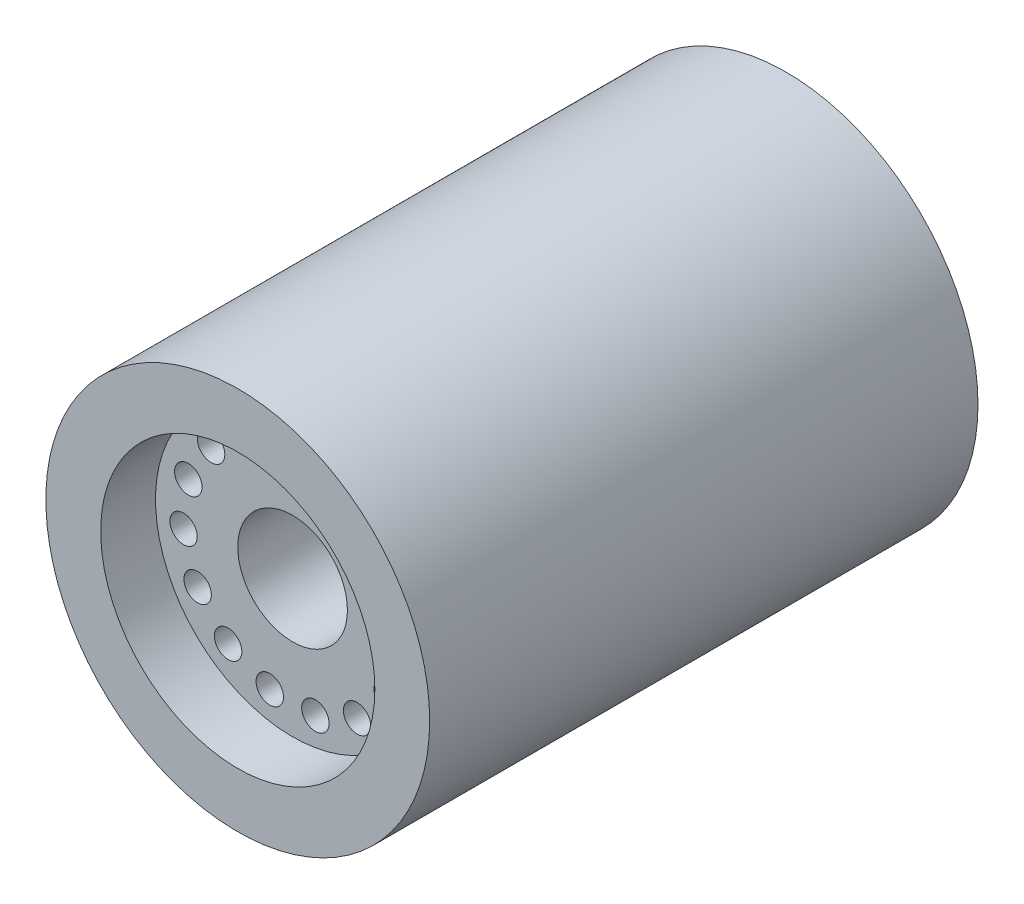
from build123d import *

# Parameters (mm, degrees)
SKETCH1_R                   = 35
BOSS_EXTRUDE1_DEPTH         = 100
SKETCH2_R                   = 2.5
CUT_EXTRUDE5_DEPTH          = 15
SKETCH2_7_R                 = 25
CUT_EXTRUDE6_DEPTH          = 10
SKETCH3_R                   = 10
CUT_EXTRUDE8_DEPTH          = 112.579568022
F_1_4_20_TAPPED_HOLE1_D     = 5.1054
F_1_4_20_TAPPED_HOLE1_DEPTH = 19.1
F_1_4_20_TAPPED_HOLE1_TIP   = 1.533816902


with BuildPart() as part:
    # Sketch1 → Boss-Extrude1 (new body)
    with BuildSketch(Plane.XY):
        Circle(SKETCH1_R)
    extrude(amount=BOSS_EXTRUDE1_DEPTH)

    # Sketch2 → Cut-Extrude5 (cut)
    with BuildSketch(Plane.XY.offset(100)):
        with Locations((0, 20)):
            Circle(SKETCH2_R)
        with Locations((8.134732862, 18.270909153)):
            Circle(SKETCH2_R)
        with Locations((14.86289651, 13.382612127)):
            Circle(SKETCH2_R)
        with Locations((19.021130326, 6.180339887)):
            Circle(SKETCH2_R)
        with Locations((19.890437907, -2.090569265)):
            Circle(SKETCH2_R)
        with Locations((17.320508076, -10)):
            Circle(SKETCH2_R)
        with Locations((11.755705046, -16.180339887)):
            Circle(SKETCH2_R)
        with Locations((4.158233816, -19.562952015)):
            Circle(SKETCH2_R)
        with Locations((-4.158233816, -19.562952015)):
            Circle(SKETCH2_R)
        with Locations((-11.755705046, -16.180339887)):
            Circle(SKETCH2_R)
        with Locations((-17.320508076, -10)):
            Circle(SKETCH2_R)
        with Locations((-19.890437907, -2.090569265)):
            Circle(SKETCH2_R)
        with Locations((-19.021130326, 6.180339887)):
            Circle(SKETCH2_R)
        with Locations((-14.86289651, 13.382612127)):
            Circle(SKETCH2_R)
        with Locations((-8.134732862, 18.270909153)):
            Circle(SKETCH2_R)
    extrude(amount=-CUT_EXTRUDE5_DEPTH, mode=Mode.SUBTRACT)

    # Sketch2<7> → Cut-Extrude6 (cut)
    with BuildSketch(Plane.XY.offset(100)):
        Circle(SKETCH2_7_R)
    extrude(amount=-CUT_EXTRUDE6_DEPTH, mode=Mode.SUBTRACT)

    # Sketch3 → Cut-Extrude8 (cut, through all)
    with BuildSketch(Plane.XY):
        Circle(SKETCH3_R)
    extrude(amount=CUT_EXTRUDE8_DEPTH, mode=Mode.SUBTRACT)

    # 1/4-20 Tapped Hole1
    with Locations(Plane(origin=(0.951346155, -34.987068189, 51.695877928), x_dir=(-0.999630519699, -0.027181318711, 0), z_dir=(0.027181318711, -0.999630519699, 0))):
        with Locations((0, 0)):
            Hole(F_1_4_20_TAPPED_HOLE1_D / 2, depth=F_1_4_20_TAPPED_HOLE1_DEPTH)
            with Locations((0, 0, -(F_1_4_20_TAPPED_HOLE1_DEPTH + F_1_4_20_TAPPED_HOLE1_TIP / 2))):  # 118° drill point
                Cone(0, F_1_4_20_TAPPED_HOLE1_D / 2, F_1_4_20_TAPPED_HOLE1_TIP, mode=Mode.SUBTRACT)


solid = part.part
